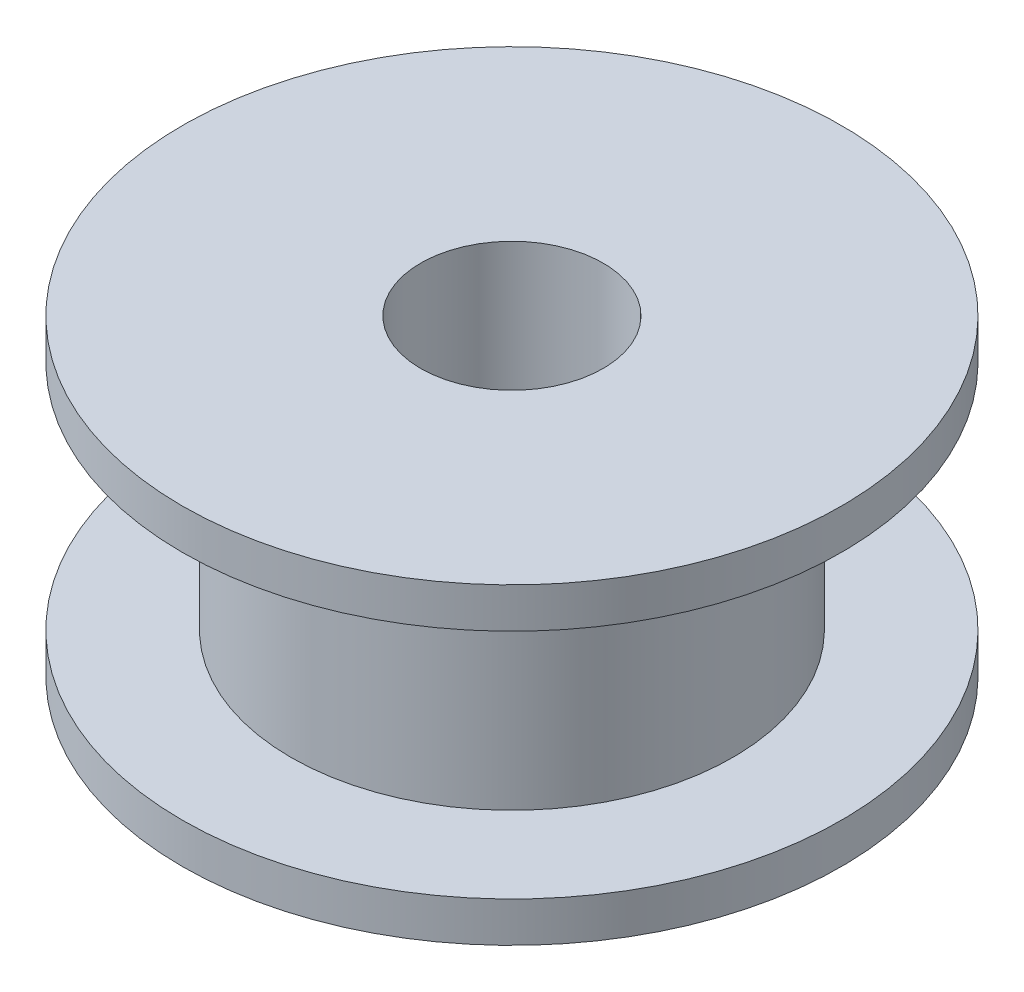
from build123d import *

# Parameters (mm, degrees)
SKETCH1_R           = 6.05
BOSS_EXTRUDE1_DEPTH = 6.35
SKETCH1_3_R         = 9.025
BOSS_EXTRUDE2_DEPTH = 1.1
BOSS_EXTRUDE3_START = 7.45
SKETCH1_4_R         = 9.025
BOSS_EXTRUDE3_DEPTH = 1.1
CUT_EXTRUDE1_REACH  = 17.362
SKETCH2_R           = 2.5


with BuildPart() as part:
    # Sketch1 → Boss-Extrude1 (new body)
    with BuildSketch(Plane(origin=(0, 0, 0), x_dir=(1, 0, 0), z_dir=(0, 1, 0))):
        Circle(SKETCH1_R)
    extrude(amount=BOSS_EXTRUDE1_DEPTH)

    # Sketch1<3> → Boss-Extrude2 (add)
    with BuildSketch(Plane(origin=(0, 0, 0), x_dir=(1, 0, 0), z_dir=(0, 1, 0))):
        Circle(SKETCH1_3_R)
    extrude(amount=-BOSS_EXTRUDE2_DEPTH)

    # Sketch1<4> → Boss-Extrude3 (add)
    with BuildSketch(Plane(origin=(0, 0, 0), x_dir=(1, 0, 0), z_dir=(0, 1, 0)).offset(BOSS_EXTRUDE3_START)):
        Circle(SKETCH1_4_R)
    extrude(amount=-BOSS_EXTRUDE3_DEPTH)

    # Sketch2 → Cut-Extrude1 (cut, up to next)
    with BuildSketch(Plane(origin=(0, 7.45, 0), x_dir=(1, 0, 0), z_dir=(0, 1, 0)), mode=Mode.PRIVATE) as cut_extrude1_sk1:
        Circle(SKETCH2_R)
    cut_extrude1_tool1 = extrude(cut_extrude1_sk1.sketch, amount=-CUT_EXTRUDE1_REACH, mode=Mode.PRIVATE) & part.part
    add(cut_extrude1_tool1.solids().sort_by_distance((0, 7.45, 0))[0], mode=Mode.SUBTRACT)


solid = part.part
